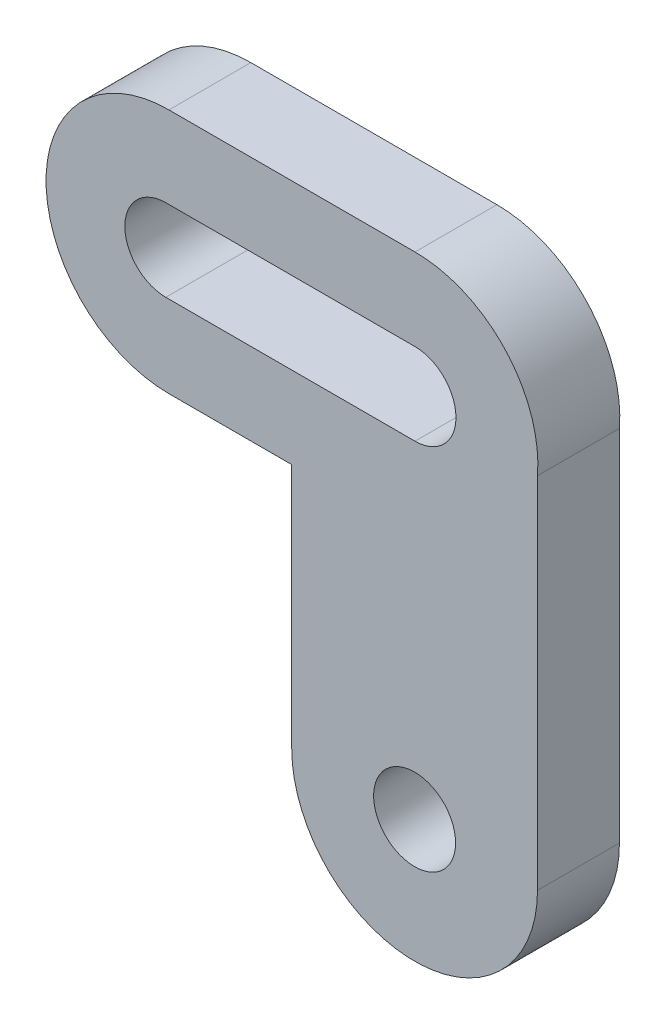
from build123d import *

# Parameters (mm, degrees)
MODEL_R                 = 1.5
SALIENTE_EXTRUIR1_DEPTH = 3


with BuildPart() as part:
    # Model → Saliente-Extruir1 (new body)
    with BuildSketch(Plane.XY):
        with BuildLine():
            Line((160.698926217, 226.370073483), (160.698926217, 239.515886932))
            ThreePointArc((160.698926217, 239.515886932), (159.517719337, 242.924264089), (156.212886551, 244.370073483))
            Line((156.212886551, 244.370073483), (147.202886551, 244.370073483))
            ThreePointArc((147.202886551, 244.370073483), (142.702886551, 239.870073483), (147.202886551, 235.370073483))
            Line((147.202886551, 235.370073483), (151.698926217, 235.370073483))
            Line((151.698926217, 235.370073483), (151.698926217, 226.370073483))
            ThreePointArc((151.698926217, 226.370073483), (156.198926217, 221.870073483), (160.698926217, 226.370073483))
        make_face()
        with Locations((156.198926217, 226.370073483)):
            Circle(MODEL_R, mode=Mode.SUBTRACT)
        with BuildLine():
            ThreePointArc((147.087886551, 238.370073483), (145.587886551, 239.870073483), (147.087886551, 241.370073483))
            Line((147.087886551, 241.370073483), (156.212886551, 241.370073483))
            ThreePointArc((156.212886551, 241.370073483), (157.712886551, 239.870073483), (156.212886551, 238.370073483))
            Line((156.212886551, 238.370073483), (147.087886551, 238.370073483))
        make_face(mode=Mode.SUBTRACT)
    extrude(amount=SALIENTE_EXTRUIR1_DEPTH)


solid = part.part
